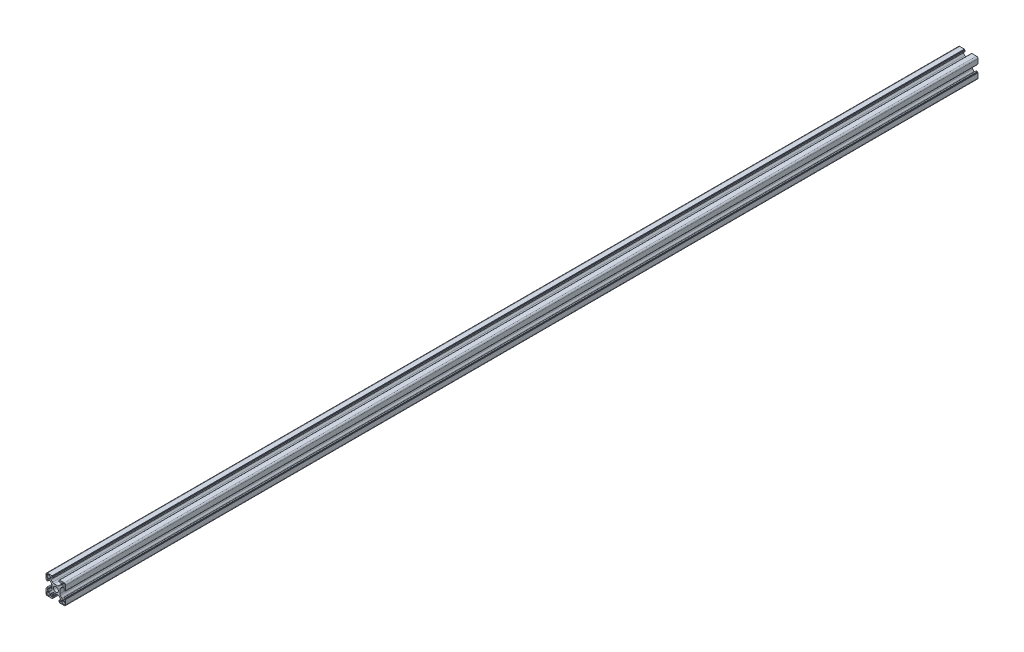
from build123d import *

# Parameters (mm, degrees)
EXTRUDE_1_DEPTH = 925


with BuildPart() as part:
    # Эскиз2 → Бобышка-Вытянуть1 (new body)
    with BuildSketch(Plane.XY):
        with BuildLine():
            Line((0.129852449, 4.683728486), (2.028633118, 4.683728486))
            ThreePointArc((2.028633118, 4.683728486), (2.793999983, 4.835969421), (3.44284668, 5.269514923))
            Line((3.44284668, 5.269514923), (4.744066011, 6.570734254))
            ThreePointArc((4.744066011, 6.570734254), (5.177611514, 7.219580952), (5.329852449, 7.984947817))
            Line((5.329852449, 7.984947817), (5.329852449, 8.883728486))
            ThreePointArc((5.329852449, 8.883728486), (5.183405839, 9.237281876), (4.829852449, 9.383728486))
            Line((4.829852449, 9.383728486), (4.72695923, 9.383728486))
            ThreePointArc((4.72695923, 9.383728486), (4.535617514, 9.345668252), (4.373405839, 9.237281876))
            Line((4.373405839, 9.237281876), (3.893075754, 8.75695179))
            ThreePointArc((3.893075754, 8.75695179), (3.811969916, 8.702758603), (3.716299058, 8.683728486))
            Line((3.716299058, 8.683728486), (3.429852449, 8.683728486))
            ThreePointArc((3.429852449, 8.683728486), (3.253075754, 8.75695179), (3.179852449, 8.933728486))
            Line((3.179852449, 8.933728486), (3.179852449, 10.082799306))
            ThreePointArc((3.179852449, 10.082799306), (3.223786432, 10.188865323), (3.329852449, 10.232799306))
            Line((3.329852449, 10.232799306), (3.829852449, 10.232799306))
            Line((3.829852449, 10.232799306), (3.829852449, 10.533728486))
            ThreePointArc((3.829852449, 10.533728486), (3.873786432, 10.639794503), (3.979852449, 10.683728486))
            Line((3.979852449, 10.683728486), (8.629852449, 10.683728486))
            ThreePointArc((8.629852449, 10.683728486), (9.690512621, 10.244388658), (10.129852449, 9.183728486))
            Line((10.129852449, 9.183728486), (10.129852449, 4.533728486))
            ThreePointArc((10.129852449, 4.533728486), (10.085918466, 4.427662469), (9.979852449, 4.383728486))
            Line((9.979852449, 4.383728486), (9.678923269, 4.383728486))
            Line((9.678923269, 4.383728486), (9.678923269, 3.883728486))
            ThreePointArc((9.678923269, 3.883728486), (9.634989287, 3.777662469), (9.528923269, 3.733728486))
            Line((9.528923269, 3.733728486), (8.379852449, 3.733728486))
            ThreePointArc((8.379852449, 3.733728486), (8.203075754, 3.80695179), (8.129852449, 3.983728486))
            Line((8.129852449, 3.983728486), (8.129852449, 4.270175095))
            ThreePointArc((8.129852449, 4.270175095), (8.148882566, 4.365845953), (8.203075754, 4.44695179))
            Line((8.203075754, 4.44695179), (8.683405839, 4.927281876))
            ThreePointArc((8.683405839, 4.927281876), (8.791792215, 5.089493551), (8.829852449, 5.280835267))
            Line((8.829852449, 5.280835267), (8.829852449, 5.383728486))
            ThreePointArc((8.829852449, 5.383728486), (8.683405839, 5.737281876), (8.329852449, 5.883728486))
            Line((8.329852449, 5.883728486), (7.43107178, 5.883728486))
            ThreePointArc((7.43107178, 5.883728486), (6.665704915, 5.731487551), (6.016858217, 5.297942048))
            Line((6.016858217, 5.297942048), (4.715638886, 3.996722717))
            ThreePointArc((4.715638886, 3.996722717), (4.282093384, 3.34787602), (4.129852449, 2.582509155))
            Line((4.129852449, 2.582509155), (4.129852449, 0.683728486))
            Line((4.129852449, 0.683728486), (4.129852449, -1.215052183))
            ThreePointArc((4.129852449, -1.215052183), (4.282093384, -1.980419048), (4.715638886, -2.629265746))
            Line((4.715638886, -2.629265746), (6.016858217, -3.930485077))
            ThreePointArc((6.016858217, -3.930485077), (6.665704915, -4.364030579), (7.43107178, -4.516271514))
            Line((7.43107178, -4.516271514), (8.329852449, -4.516271514))
            ThreePointArc((8.329852449, -4.516271514), (8.683405839, -4.369824905), (8.829852449, -4.016271514))
            Line((8.829852449, -4.016271514), (8.829852449, -3.913378295))
            ThreePointArc((8.829852449, -3.913378295), (8.791792215, -3.722036579), (8.683405839, -3.559824905))
            Line((8.683405839, -3.559824905), (8.203075754, -3.079494819))
            ThreePointArc((8.203075754, -3.079494819), (8.148882566, -2.998388982), (8.129852449, -2.902718124))
            Line((8.129852449, -2.902718124), (8.129852449, -2.616271514))
            ThreePointArc((8.129852449, -2.616271514), (8.203075754, -2.439494819), (8.379852449, -2.366271514))
            Line((8.379852449, -2.366271514), (9.528923269, -2.366271514))
            ThreePointArc((9.528923269, -2.366271514), (9.634989287, -2.410205497), (9.678923269, -2.516271514))
            Line((9.678923269, -2.516271514), (9.678923269, -3.016271514))
            Line((9.678923269, -3.016271514), (9.979852449, -3.016271514))
            ThreePointArc((9.979852449, -3.016271514), (10.085918466, -3.060205497), (10.129852449, -3.166271514))
            Line((10.129852449, -3.166271514), (10.129852449, -7.816271514))
            ThreePointArc((10.129852449, -7.816271514), (9.690512621, -8.876931686), (8.629852449, -9.316271514))
            Line((8.629852449, -9.316271514), (3.979852449, -9.316271514))
            ThreePointArc((3.979852449, -9.316271514), (3.873786432, -9.272337531), (3.829852449, -9.166271514))
            Line((3.829852449, -9.166271514), (3.829852449, -8.865342335))
            Line((3.829852449, -8.865342335), (3.329852449, -8.865342335))
            ThreePointArc((3.329852449, -8.865342335), (3.223786432, -8.821408352), (3.179852449, -8.715342335))
            Line((3.179852449, -8.715342335), (3.179852449, -7.566271514))
            ThreePointArc((3.179852449, -7.566271514), (3.253075754, -7.389494819), (3.429852449, -7.316271514))
            Line((3.429852449, -7.316271514), (3.716299058, -7.316271514))
            ThreePointArc((3.716299058, -7.316271514), (3.811969916, -7.335301631), (3.893075754, -7.389494819))
            Line((3.893075754, -7.389494819), (4.373405839, -7.869824905))
            ThreePointArc((4.373405839, -7.869824905), (4.535617514, -7.978211281), (4.72695923, -8.016271514))
            Line((4.72695923, -8.016271514), (4.829852449, -8.016271514))
            ThreePointArc((4.829852449, -8.016271514), (5.183405839, -7.869824905), (5.329852449, -7.516271514))
            Line((5.329852449, -7.516271514), (5.329852449, -6.617490845))
            ThreePointArc((5.329852449, -6.617490845), (5.177611514, -5.85212398), (4.744066011, -5.203277283))
            Line((4.744066011, -5.203277283), (3.44284668, -3.902057952))
            ThreePointArc((3.44284668, -3.902057952), (2.793999983, -3.468512449), (2.028633118, -3.316271514))
            Line((2.028633118, -3.316271514), (0.129852449, -3.316271514))
            Line((0.129852449, -3.316271514), (-1.76892822, -3.316271514))
            ThreePointArc((-1.76892822, -3.316271514), (-2.534295085, -3.468512449), (-3.183141783, -3.902057952))
            Line((-3.183141783, -3.902057952), (-4.484361114, -5.203277283))
            ThreePointArc((-4.484361114, -5.203277283), (-4.917906616, -5.85212398), (-5.070147551, -6.617490845))
            Line((-5.070147551, -6.617490845), (-5.070147551, -7.516271514))
            ThreePointArc((-5.070147551, -7.516271514), (-4.923700942, -7.869824905), (-4.570147551, -8.016271514))
            Line((-4.570147551, -8.016271514), (-4.467254332, -8.016271514))
            ThreePointArc((-4.467254332, -8.016271514), (-4.275912616, -7.978211281), (-4.113700942, -7.869824905))
            Line((-4.113700942, -7.869824905), (-3.633370856, -7.389494819))
            ThreePointArc((-3.633370856, -7.389494819), (-3.552265019, -7.335301631), (-3.456594161, -7.316271514))
            Line((-3.456594161, -7.316271514), (-3.170147551, -7.316271514))
            ThreePointArc((-3.170147551, -7.316271514), (-2.993370856, -7.389494819), (-2.920147551, -7.566271514))
            Line((-2.920147551, -7.566271514), (-2.920147551, -8.715342335))
            ThreePointArc((-2.920147551, -8.715342335), (-2.964081534, -8.821408352), (-3.070147551, -8.865342335))
            Line((-3.070147551, -8.865342335), (-3.570147551, -8.865342335))
            Line((-3.570147551, -8.865342335), (-3.570147551, -9.166271514))
            ThreePointArc((-3.570147551, -9.166271514), (-3.614081534, -9.272337531), (-3.720147551, -9.316271514))
            Line((-3.720147551, -9.316271514), (-8.370147551, -9.316271514))
            ThreePointArc((-8.370147551, -9.316271514), (-9.430807723, -8.876931686), (-9.870147551, -7.816271514))
            Line((-9.870147551, -7.816271514), (-9.870147551, -3.166271514))
            ThreePointArc((-9.870147551, -3.166271514), (-9.826213568, -3.060205497), (-9.720147551, -3.016271514))
            Line((-9.720147551, -3.016271514), (-9.419218372, -3.016271514))
            Line((-9.419218372, -3.016271514), (-9.419218372, -2.516271514))
            ThreePointArc((-9.419218372, -2.516271514), (-9.375284389, -2.410205497), (-9.269218372, -2.366271514))
            Line((-9.269218372, -2.366271514), (-8.120147551, -2.366271514))
            ThreePointArc((-8.120147551, -2.366271514), (-7.943370856, -2.439494819), (-7.870147551, -2.616271514))
            Line((-7.870147551, -2.616271514), (-7.870147551, -2.902718124))
            ThreePointArc((-7.870147551, -2.902718124), (-7.889177668, -2.998388982), (-7.943370856, -3.079494819))
            Line((-7.943370856, -3.079494819), (-8.423700942, -3.559824905))
            ThreePointArc((-8.423700942, -3.559824905), (-8.532087317, -3.722036579), (-8.570147551, -3.913378295))
            Line((-8.570147551, -3.913378295), (-8.570147551, -4.016271514))
            ThreePointArc((-8.570147551, -4.016271514), (-8.423700942, -4.369824905), (-8.070147551, -4.516271514))
            Line((-8.070147551, -4.516271514), (-7.171366882, -4.516271514))
            ThreePointArc((-7.171366882, -4.516271514), (-6.406000017, -4.364030579), (-5.75715332, -3.930485077))
            Line((-5.75715332, -3.930485077), (-4.455933989, -2.629265746))
            ThreePointArc((-4.455933989, -2.629265746), (-4.022388486, -1.980419048), (-3.870147551, -1.215052183))
            Line((-3.870147551, -1.215052183), (-3.870147551, 0.683728486))
            Line((-3.870147551, 0.683728486), (-3.870147551, 2.582509155))
            ThreePointArc((-3.870147551, 2.582509155), (-4.022388486, 3.34787602), (-4.455933989, 3.996722717))
            Line((-4.455933989, 3.996722717), (-5.75715332, 5.297942048))
            ThreePointArc((-5.75715332, 5.297942048), (-6.406000017, 5.731487551), (-7.171366882, 5.883728486))
            Line((-7.171366882, 5.883728486), (-8.070147551, 5.883728486))
            ThreePointArc((-8.070147551, 5.883728486), (-8.423700942, 5.737281876), (-8.570147551, 5.383728486))
            Line((-8.570147551, 5.383728486), (-8.570147551, 5.280835267))
            ThreePointArc((-8.570147551, 5.280835267), (-8.532087317, 5.089493551), (-8.423700942, 4.927281876))
            Line((-8.423700942, 4.927281876), (-7.943370856, 4.44695179))
            ThreePointArc((-7.943370856, 4.44695179), (-7.889177668, 4.365845953), (-7.870147551, 4.270175095))
            Line((-7.870147551, 4.270175095), (-7.870147551, 3.983728486))
            ThreePointArc((-7.870147551, 3.983728486), (-7.943370856, 3.80695179), (-8.120147551, 3.733728486))
            Line((-8.120147551, 3.733728486), (-9.269218372, 3.733728486))
            ThreePointArc((-9.269218372, 3.733728486), (-9.375284389, 3.777662469), (-9.419218372, 3.883728486))
            Line((-9.419218372, 3.883728486), (-9.419218372, 4.383728486))
            Line((-9.419218372, 4.383728486), (-9.720147551, 4.383728486))
            ThreePointArc((-9.720147551, 4.383728486), (-9.826213568, 4.427662469), (-9.870147551, 4.533728486))
            Line((-9.870147551, 4.533728486), (-9.870147551, 9.183728486))
            ThreePointArc((-9.870147551, 9.183728486), (-9.430807723, 10.244388658), (-8.370147551, 10.683728486))
            Line((-8.370147551, 10.683728486), (-3.720147551, 10.683728486))
            ThreePointArc((-3.720147551, 10.683728486), (-3.614081534, 10.639794503), (-3.570147551, 10.533728486))
            Line((-3.570147551, 10.533728486), (-3.570147551, 10.232799306))
            Line((-3.570147551, 10.232799306), (-3.070147551, 10.232799306))
            ThreePointArc((-3.070147551, 10.232799306), (-2.964081534, 10.188865323), (-2.920147551, 10.082799306))
            Line((-2.920147551, 10.082799306), (-2.920147551, 8.933728486))
            ThreePointArc((-2.920147551, 8.933728486), (-2.993370856, 8.75695179), (-3.170147551, 8.683728486))
            Line((-3.170147551, 8.683728486), (-3.456594161, 8.683728486))
            ThreePointArc((-3.456594161, 8.683728486), (-3.552265019, 8.702758603), (-3.633370856, 8.75695179))
            Line((-3.633370856, 8.75695179), (-4.113700942, 9.237281876))
            ThreePointArc((-4.113700942, 9.237281876), (-4.275912616, 9.345668252), (-4.467254332, 9.383728486))
            Line((-4.467254332, 9.383728486), (-4.570147551, 9.383728486))
            ThreePointArc((-4.570147551, 9.383728486), (-4.923700942, 9.237281876), (-5.070147551, 8.883728486))
            Line((-5.070147551, 8.883728486), (-5.070147551, 7.984947817))
            ThreePointArc((-5.070147551, 7.984947817), (-4.917906616, 7.219580952), (-4.484361114, 6.570734254))
            Line((-4.484361114, 6.570734254), (-3.183141783, 5.269514923))
            ThreePointArc((-3.183141783, 5.269514923), (-2.534295085, 4.835969421), (-1.76892822, 4.683728486))
            Line((-1.76892822, 4.683728486), (0.129852449, 4.683728486))
        make_face()
        with BuildLine():
            Line((7.029852449, 6.783728486), (8.429852449, 6.783728486))
            ThreePointArc((8.429852449, 6.783728486), (8.995537874, 7.018043061), (9.229852449, 7.583728486))
            Line((9.229852449, 7.583728486), (9.229852449, 8.983728486))
            ThreePointArc((9.229852449, 8.983728486), (8.995537874, 9.549413911), (8.429852449, 9.783728486))
            Line((8.429852449, 9.783728486), (7.029852449, 9.783728486))
            ThreePointArc((7.029852449, 9.783728486), (6.464167024, 9.549413911), (6.229852449, 8.983728486))
            Line((6.229852449, 8.983728486), (6.229852449, 7.583728486))
            ThreePointArc((6.229852449, 7.583728486), (6.464167024, 7.018043061), (7.029852449, 6.783728486))
        make_face(mode=Mode.SUBTRACT)
        with BuildLine():
            Line((6.229852449, -6.216271514), (6.229852449, -7.616271514))
            ThreePointArc((6.229852449, -7.616271514), (6.464167024, -8.181956939), (7.029852449, -8.416271514))
            Line((7.029852449, -8.416271514), (8.429852449, -8.416271514))
            ThreePointArc((8.429852449, -8.416271514), (8.995537874, -8.181956939), (9.229852449, -7.616271514))
            Line((9.229852449, -7.616271514), (9.229852449, -6.216271514))
            ThreePointArc((9.229852449, -6.216271514), (8.995537874, -5.650586089), (8.429852449, -5.416271514))
            Line((8.429852449, -5.416271514), (7.029852449, -5.416271514))
            ThreePointArc((7.029852449, -5.416271514), (6.464167024, -5.650586089), (6.229852449, -6.216271514))
        make_face(mode=Mode.SUBTRACT)
        with BuildLine():
            Line((-6.770147551, -5.416271514), (-8.170147551, -5.416271514))
            ThreePointArc((-8.170147551, -5.416271514), (-8.735832976, -5.650586089), (-8.970147551, -6.216271514))
            Line((-8.970147551, -6.216271514), (-8.970147551, -7.616271514))
            ThreePointArc((-8.970147551, -7.616271514), (-8.735832976, -8.181956939), (-8.170147551, -8.416271514))
            Line((-8.170147551, -8.416271514), (-6.770147551, -8.416271514))
            ThreePointArc((-6.770147551, -8.416271514), (-6.204462126, -8.181956939), (-5.970147551, -7.616271514))
            Line((-5.970147551, -7.616271514), (-5.970147551, -6.216271514))
            ThreePointArc((-5.970147551, -6.216271514), (-6.204462126, -5.650586089), (-6.770147551, -5.416271514))
        make_face(mode=Mode.SUBTRACT)
        with BuildLine():
            Line((-5.970147551, 7.583728486), (-5.970147551, 8.983728486))
            ThreePointArc((-5.970147551, 8.983728486), (-6.204462126, 9.549413911), (-6.770147551, 9.783728486))
            Line((-6.770147551, 9.783728486), (-8.170147551, 9.783728486))
            ThreePointArc((-8.170147551, 9.783728486), (-8.735832976, 9.549413911), (-8.970147551, 8.983728486))
            Line((-8.970147551, 8.983728486), (-8.970147551, 7.583728486))
            ThreePointArc((-8.970147551, 7.583728486), (-8.735832976, 7.018043061), (-8.170147551, 6.783728486))
            Line((-8.170147551, 6.783728486), (-6.770147551, 6.783728486))
            ThreePointArc((-6.770147551, 6.783728486), (-6.204462126, 7.018043061), (-5.970147551, 7.583728486))
        make_face(mode=Mode.SUBTRACT)
        with BuildLine():
            ThreePointArc((2.629852449, 0.683728486), (1.897619402, 2.451495439), (0.129852449, 3.183728486))
            ThreePointArc((0.129852449, 3.183728486), (-1.637914504, 2.451495439), (-2.370147551, 0.683728486))
            ThreePointArc((-2.370147551, 0.683728486), (-1.637914504, -1.084038467), (0.129852449, -1.816271514))
            ThreePointArc((0.129852449, -1.816271514), (1.897619402, -1.084038467), (2.629852449, 0.683728486))
        make_face(mode=Mode.SUBTRACT)
    extrude(amount=EXTRUDE_1_DEPTH)


solid = part.part
